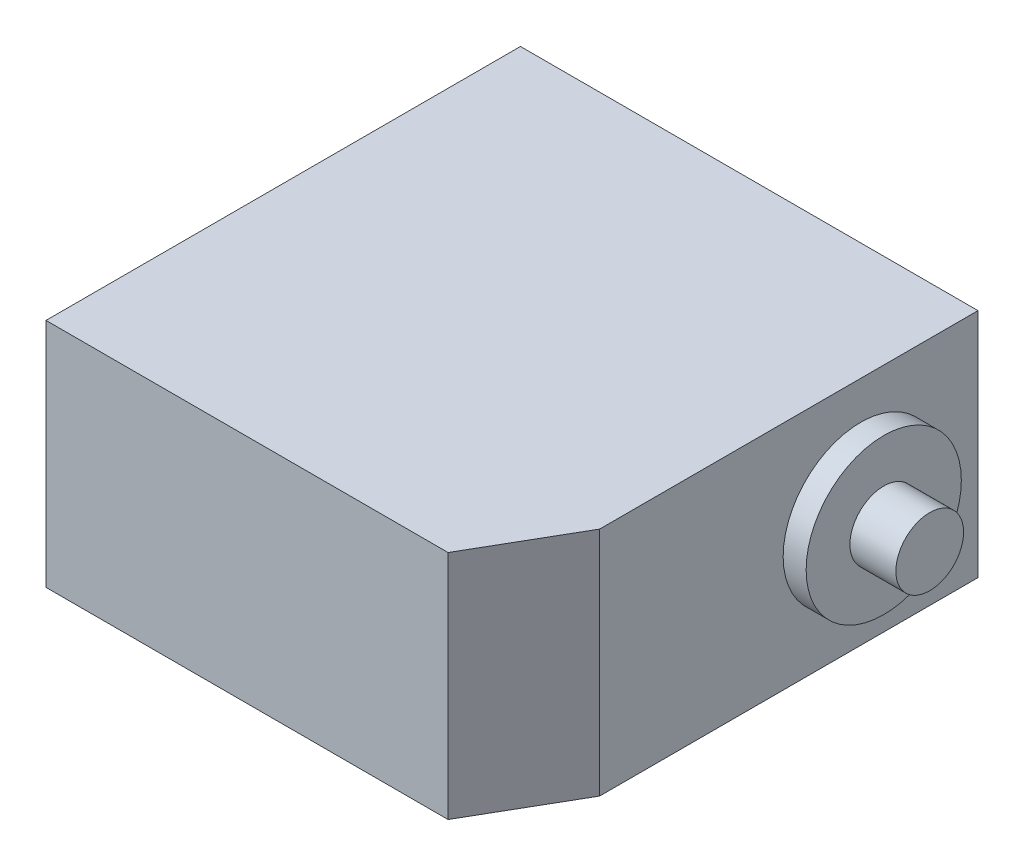
from build123d import *

# Parameters (mm, degrees)
BOSS_EXTRUDE1_DEPTH = 20.1168
SKETCH2_R           = 6.75
BOSS_EXTRUDE2_DEPTH = 2
SKETCH3_R           = 2.945
BOSS_EXTRUDE3_DEPTH = 4


with BuildPart() as part:
    # Sketch1 → Boss-Extrude1 (new body)
    with BuildSketch(Plane(origin=(0, 0, 0), x_dir=(1, 0, 0), z_dir=(0, 1, 0))):
        Polygon((19.9009, -12.278622803), (15.0749, -20.6375), (-19.9009, -20.6375), (-19.9009, 20.6375), (19.9009, 20.6375), align=None)
    extrude(amount=BOSS_EXTRUDE1_DEPTH)

    # Sketch2 → Boss-Extrude2 (add)
    with BuildSketch(Plane(origin=(19.9009, 0, 0), x_dir=(0, 0, -1), z_dir=(1, 0, 0))):
        with Locations(Location((10.4375, 10.0584, 0), (0, 0, 180))):
            Circle(SKETCH2_R)
    extrude(amount=BOSS_EXTRUDE2_DEPTH)

    # Sketch3 → Boss-Extrude3 (add)
    with BuildSketch(Plane(origin=(21.9009, 0, 0), x_dir=(0, 0, -1), z_dir=(1, 0, 0))):
        with Locations((10.4375, 10.0584)):
            Circle(SKETCH3_R)
    extrude(amount=BOSS_EXTRUDE3_DEPTH)


solid = part.part
